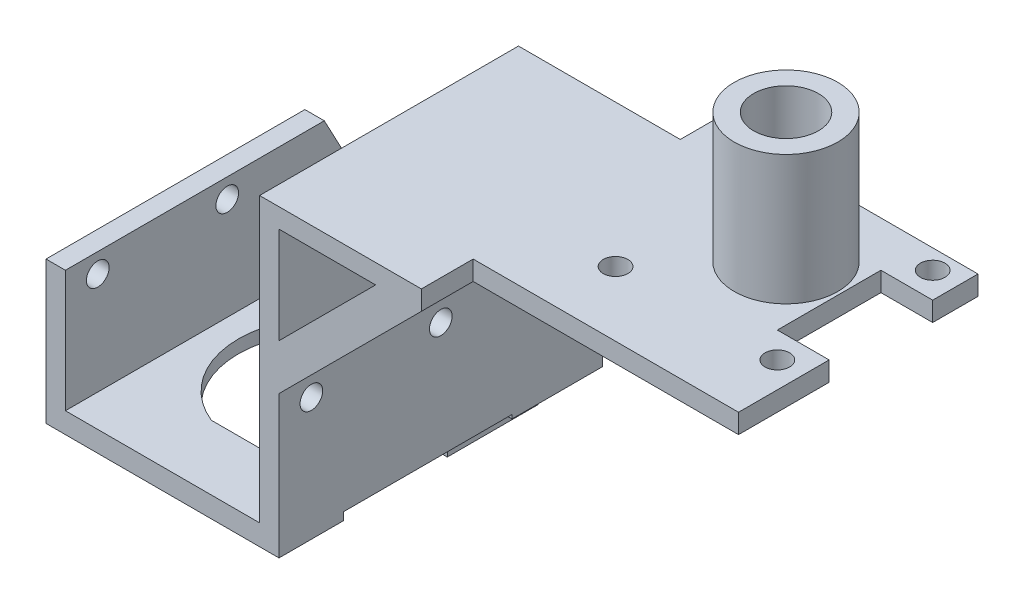
from build123d import *

# Parameters (mm, degrees)
SKETCH_1_W            = 36
SKETCH_1_H            = 40
EXTRUDE_1_DEPTH       = 3
SKETCH_2_W            = 3
SKETCH_2_H            = 40
EXTRUDE_2_DEPTH       = 18.8
SKETCH_3_R            = 14
CUT_EXTRUDE_1_DEPTH   = 9
SKETCH_4_W            = 36
SKETCH_4_H            = 3
EXTRUDE_3_DEPTH       = 10
SKETCH_6_R            = 2.7
CUT_EXTRUDE_3_DEPTH   = 10
SKETCH_7_R            = 1.75
CUT_EXTRUDE_4_DEPTH   = 52.68404009
SKETCH_9_W            = 25
SKETCH_9_H            = 3
SKETCH_9_W_2          = 3
SKETCH_9_H_2          = 9.3
EXTRUDE_4_DEPTH       = 20
CHAMFER_1_SIZE        = 5
CUT_EXTRUDE_START     = -30
SKETCH_10_R           = 2.7
CUT_EXTRUDE_5_DEPTH   = 30
SKETCH_11_W           = 40.05397725
SKETCH_11_H           = 18.071111192
CUT_EXTRUDE_6_DEPTH   = 52.68404009
EXTRUDE_START         = 2.5
SKETCH_12_W           = 36
SKETCH_12_H           = 20
SKETCH_12_R           = 2.7
EXTRUDE_5_DEPTH       = 2.5
SKETCH_13_W           = 62.12277329
SKETCH_13_H           = 35.561448302
CUT_EXTRUDE_7_DEPTH   = 1
SKETCH_16_W           = 60
SKETCH_16_H           = 3
SKETCH_16_W_2         = 3
SKETCH_16_H_2         = 25
EXTRUDE_7_DEPTH       = 65
EXTRUDE_START_2       = 8
EXTRUDE_8_DEPTH       = 8
SKETCH_19_W           = 125.229267156
SKETCH_19_H           = 103.922898786
CUT_EXTRUDE_9_DEPTH   = 0.5
SKETCH_20_W           = 154.797288569
SKETCH_20_H           = 90.443359613
CUT_EXTRUDE_10_DEPTH  = 1.8
SKETCH_21_W           = 11.155684717
SKETCH_21_H           = 2.603751016
EXTRUDE_9_DEPTH       = 3
EXTRUDE_10_DEPTH      = 10
EXTRUDE_10_DEPTH_BACK = 4
SKETCH_22_W           = 36
SKETCH_22_H           = 3.2
SKETCH_23_R           = 1.75
CUT_EXTRUDE_12_DEPTH  = 10
SKETCH_26_W           = 12.845915964
SKETCH_26_H           = 7.377373426
EXTRUDE_11_DEPTH      = 3.2
SKETCH_27_W           = 116.42408431
SKETCH_27_H           = 62.505927617
CUT_EXTRUDE_13_DEPTH  = 10
SKETCH_29_W           = 89.791123847
SKETCH_29_H           = 12.28472202
SKETCH_29_W_2         = 107.401489541
SKETCH_29_H_2         = 29.785433334
CUT_EXTRUDE_14_DEPTH  = 25
SKETCH_30_W           = 3
SKETCH_30_H           = 18.8
EXTRUDE_12_DEPTH      = 17
SKETCH_31_W           = 80.768529078
SKETCH_31_H           = 45.765209612
CUT_EXTRUDE_15_DEPTH  = 0.6
SKETCH_32_W           = 23
SKETCH_32_H           = 2.8
SKETCH_32_W_2         = 3
SKETCH_32_H_2         = 9.9
EXTRUDE_13_DEPTH      = 14
SKETCH_34_R           = 2.2
CUT_EXTRUDE_17_DEPTH  = 97.806198149
SKETCH_35_W           = 168.711651586
SKETCH_35_H           = 128.925269833
CUT_EXTRUDE_18_DEPTH  = 7
SKETCH_36_W           = 30.780953922
SKETCH_36_H           = 20.383466973
CUT_EXTRUDE_19_DEPTH  = 43.8
SKETCH_38_W           = 37
SKETCH_38_H           = 5
CUT_EXTRUDE_20_DEPTH  = 10
SKETCH_45_W           = 37
SKETCH_45_H           = 3
EXTRUDE_14_DEPTH      = 3
HOLE_WIZARD_1_D       = 3.8
SKETCH_51_W           = 37
SKETCH_51_H           = 8
CUT_EXTRUDE_21_DEPTH  = 10
EXTRUDE_15_DEPTH      = 3
EXTRUDE_16_DEPTH      = 3
EXTRUDE_17_DEPTH      = 8
EXTRUDE_18_DEPTH      = 1.5
SKETCH_58_W           = 5
SKETCH_58_H           = 7.3
EXTRUDE_19_DEPTH      = 3
SKETCH_59_W           = 38
SKETCH_59_H           = 5
EXTRUDE_20_DEPTH      = 3
HOLE_WIZARD_2_D       = 3.8
SKETCH_62_W           = 37
SKETCH_62_H           = 3
EXTRUDE_21_DEPTH      = 3
HOLE_WIZARD_3_D       = 3.8
HOLE_WIZARD_3_DEPTH   = 56.5
SKETCH_65_W           = 8
SKETCH_65_H           = 16
CUT_EXTRUDE_22_DEPTH  = 10
SKETCH_73_R           = 8
EXTRUDE_22_DEPTH      = 20
SKETCH_74_R           = 5
CUT_EXTRUDE_23_DEPTH  = 20
HOLE_WIZARD_4_D       = 8


with BuildPart() as part:
    # 草图1 → 凸台-拉伸1 (new body)
    with BuildSketch(Plane(origin=(0, 0, 0), x_dir=(1, 0, 0), z_dir=(0, 1, 0))):
        Rectangle(SKETCH_1_W, SKETCH_1_H)
    extrude(amount=EXTRUDE_1_DEPTH)

    # 草图2 → 凸台-拉伸2 (add)
    with BuildSketch(Plane(origin=(0, 3, 0), x_dir=(1, 0, 0), z_dir=(0, 1, 0))):
        with Locations((-16.5, 0)):
            Rectangle(SKETCH_2_W, SKETCH_2_H)
        with Locations((16.5, 0)):
            Rectangle(SKETCH_2_W, SKETCH_2_H)
    extrude(amount=EXTRUDE_2_DEPTH)

    # 草图3 → 切除-拉伸1 (cut)
    with BuildSketch(Plane(origin=(0, 0, 0), x_dir=(-1, 0, 0), z_dir=(0, -1, 0))):
        with Locations(Location((-2.75, 3.000025, 0), (0, 0, 90))):
            Circle(SKETCH_3_R)
    extrude(amount=-CUT_EXTRUDE_1_DEPTH, mode=Mode.SUBTRACT)

    # 草图4 → 凸台-拉伸3 (add)
    with BuildSketch(Plane.XY.offset(20)):
        with Locations((0, 1.5)):
            Rectangle(SKETCH_4_W, SKETCH_4_H)
    extrude(amount=EXTRUDE_3_DEPTH)

    # 草图6 → 切除-拉伸3 (cut)
    with BuildSketch(Plane(origin=(0, 0, 0), x_dir=(-1, 0, 0), z_dir=(0, -1, 0))):
        with Locations(Location((-2.75, -16.149975, 0), (0, 0, 90))):
            Circle(SKETCH_6_R)
    extrude(amount=-CUT_EXTRUDE_3_DEPTH, mode=Mode.SUBTRACT)

    # 草图7 → 切除-拉伸4 (cut, through all)
    with BuildSketch(Plane.ZY.offset(18)):
        with Locations((15, 18.8)):
            Circle(SKETCH_7_R)
        with Locations((-5, 18.8)):
            Circle(SKETCH_7_R)
    extrude(amount=-CUT_EXTRUDE_4_DEPTH, mode=Mode.SUBTRACT)

    # 草图9 → 凸台-拉伸4 (add)
    with BuildSketch(Plane.XY.offset(30)):
        with Locations((-2.5, -7.8)):
            Rectangle(SKETCH_9_W, SKETCH_9_H)
        with Locations((-16.5, -4.65)):
            Rectangle(SKETCH_9_W_2, SKETCH_9_H_2)
    extrude(amount=-EXTRUDE_4_DEPTH)

    # 倒角1
    chamfer_1_edges = [part.edges().sort_by_distance(p)[0] for p in [
        (10, -7.8, 30),
    ]]
    chamfer(chamfer_1_edges, length=CHAMFER_1_SIZE)

    # 草图10 → 切除-拉伸5 (cut)
    with BuildSketch(Plane(origin=(0, 0, 0), x_dir=(1, 0, 0), z_dir=(0, 1, 0)).offset(CUT_EXTRUDE_START)):
        with Locations(Location((2.75, -16.149975, 0), (0, 0, 90))):
            Circle(SKETCH_10_R)
    extrude(amount=CUT_EXTRUDE_5_DEPTH, mode=Mode.SUBTRACT)

    # 草图11 → 切除-拉伸6 (cut, through all)
    with BuildSketch(Plane.ZY.offset(18)):
        with Locations((20.026988625, -9.035555596)):
            Rectangle(SKETCH_11_W, SKETCH_11_H)
    extrude(amount=-CUT_EXTRUDE_6_DEPTH, mode=Mode.SUBTRACT)

    # 草图12 → 凸台-拉伸5 (add)
    with BuildSketch(Plane(origin=(0, 0, 0), x_dir=(-1, 0, 0), z_dir=(0, -1, 0)).offset(EXTRUDE_START)):
        with Locations((0, -20)):
            Rectangle(SKETCH_12_W, SKETCH_12_H)
        with Locations(Location((-2.75, -16.149975, 0), (0, 0, 90))):
            Circle(SKETCH_12_R, mode=Mode.SUBTRACT)
    extrude(amount=-EXTRUDE_5_DEPTH)

    # 草图13 → 切除-拉伸7 (cut)
    with BuildSketch(Plane(origin=(0, 0, 0), x_dir=(-1, 0, 0), z_dir=(0, -1, 0))):
        with Locations((0.086945799, 7.780724151)):
            Rectangle(SKETCH_13_W, SKETCH_13_H)
    extrude(amount=-CUT_EXTRUDE_7_DEPTH, mode=Mode.SUBTRACT)

    # 草图16 → 凸台-拉伸7 (add)
    with BuildSketch(Plane.XY.offset(20)):
        with Locations((48, 45.3)):
            Rectangle(SKETCH_16_W, SKETCH_16_H)
        with Locations((16.5, 34.3)):
            Rectangle(SKETCH_16_W_2, SKETCH_16_H_2)
    extrude(amount=-EXTRUDE_7_DEPTH)

    # 草图17 → 凸台-拉伸8 (add)
    with BuildSketch(Plane(origin=(0, 9, 0), x_dir=(-1, 0, 0), z_dir=(0, -1, 0)).offset(EXTRUDE_START_2)):
        with BuildLine():
            Line((-15, -3.777695856), (-15, 9.777745856))
            ThreePointArc((-15, 9.777745856), (-16.75, 3.000025), (-15, -3.777695856))
        make_face()
    extrude(amount=-EXTRUDE_8_DEPTH)

    # 草图19 → 切除-拉伸9 (cut)
    with BuildSketch(Plane(origin=(0, -2.5, 0), x_dir=(-1, 0, 0), z_dir=(0, -1, 0))):
        with Locations((5.272239112, -16.1971882)):
            Rectangle(SKETCH_19_W, SKETCH_19_H)
    extrude(amount=-CUT_EXTRUDE_9_DEPTH, mode=Mode.SUBTRACT)

    # 草图20 → 切除-拉伸10 (cut)
    with BuildSketch(Plane(origin=(0, -2, 0), x_dir=(-1, 0, 0), z_dir=(0, -1, 0))):
        with Locations((2.880707968, -7.718123237)):
            Rectangle(SKETCH_20_W, SKETCH_20_H)
    extrude(amount=-CUT_EXTRUDE_10_DEPTH, mode=Mode.SUBTRACT)

    # 草图21 → 凸台-拉伸9 (add)
    with BuildSketch(Plane(origin=(0, 0, 0), x_dir=(1, 0, 0), z_dir=(0, 1, 0))):
        with Locations((3.131752483, -11.301875508)):
            Rectangle(SKETCH_21_W, SKETCH_21_H)
    extrude(amount=EXTRUDE_9_DEPTH)

    # 草图22 → 凸台-拉伸10 (add, two sides: drawn at the far end of the back side and taken through both)
    with BuildSketch(Plane(origin=(0, 0, -20), x_dir=(-1, 0, 0), z_dir=(0, 0, -1)).offset(-EXTRUDE_10_DEPTH_BACK)):
        with Locations((0, 1.4)):
            Rectangle(SKETCH_22_W, SKETCH_22_H)
    extrude(amount=EXTRUDE_10_DEPTH + EXTRUDE_10_DEPTH_BACK)

    # 草图23 → 切除-拉伸12 (cut)
    with BuildSketch(Plane(origin=(0, 9, 0), x_dir=(-1, 0, 0), z_dir=(0, -1, 0))):
        with Locations(Location((-2.75, 22.150025, 0), (0, 0, 270))):
            Circle(SKETCH_23_R)
    extrude(amount=CUT_EXTRUDE_12_DEPTH, mode=Mode.SUBTRACT)

    # 草图26 → 凸台-拉伸11 (add, through all)
    with BuildSketch(Plane(origin=(0, 3, 0), x_dir=(1, 0, 0), z_dir=(0, 1, 0))):
        with Locations((3.420651678, -16.929062366)):
            Rectangle(SKETCH_26_W, SKETCH_26_H)
    extrude(amount=-EXTRUDE_11_DEPTH)

    # 草图27 → 切除-拉伸13 (cut)
    with BuildSketch(Plane.XY.offset(30)):
        with Locations((4.783062287, -2.648783639)):
            Rectangle(SKETCH_27_W, SKETCH_27_H)
    extrude(amount=-CUT_EXTRUDE_13_DEPTH, mode=Mode.SUBTRACT)

    # 草图29 → 切除-拉伸14 (cut)
    with BuildSketch(Plane(origin=(0, 46.8, 0), x_dir=(1, 0, 0), z_dir=(0, 1, 0))):
        with Locations((43.319325488, 43.14236101)):
            Rectangle(SKETCH_29_W, SKETCH_29_H)
        with Locations((56.472746777, -26.892716667)):
            Rectangle(SKETCH_29_W_2, SKETCH_29_H_2)
    extrude(amount=-CUT_EXTRUDE_14_DEPTH, mode=Mode.SUBTRACT)

    # 草图30 → 凸台-拉伸12 (add)
    with BuildSketch(Plane(origin=(0, 0, -20), x_dir=(-1, 0, 0), z_dir=(0, 0, -1))):
        with Locations((-16.5, 12.4)):
            Rectangle(SKETCH_30_W, SKETCH_30_H)
    extrude(amount=EXTRUDE_12_DEPTH)

    # 草图31 → 切除-拉伸15 (cut)
    with BuildSketch(Plane(origin=(0, -0.2, 0), x_dir=(-1, 0, 0), z_dir=(0, -1, 0))):
        with Locations((-3.369884793, 29.731080354)):
            Rectangle(SKETCH_31_W, SKETCH_31_H)
    extrude(amount=-CUT_EXTRUDE_15_DEPTH, mode=Mode.SUBTRACT)

    # 草图32 → 凸台-拉伸13 (add)
    with BuildSketch(Plane(origin=(0, 0, -30), x_dir=(-1, 0, 0), z_dir=(0, 0, -1))):
        with Locations((3.5, -8.3)):
            Rectangle(SKETCH_32_W, SKETCH_32_H)
        with Locations((16.5, -1.95)):
            Rectangle(SKETCH_32_W_2, SKETCH_32_H_2)
        with Locations((16.5, -8.3)):
            Rectangle(SKETCH_32_W_2, SKETCH_32_H)
    extrude(amount=-EXTRUDE_13_DEPTH)

    # 草图34 → 切除-拉伸17 (cut, through all)
    with BuildSketch(Plane(origin=(0, 3, 0), x_dir=(1, 0, 0), z_dir=(0, 1, 0))):
        with Locations(Location((2.75, 22.150025, 0), (0, 0, 270))):
            Circle(SKETCH_34_R)
    extrude(amount=-CUT_EXTRUDE_17_DEPTH, mode=Mode.SUBTRACT)

    # 草图35 → 切除-拉伸18 (cut)
    with BuildSketch(Plane(origin=(0, 0, -37), x_dir=(-1, 0, 0), z_dir=(0, 0, -1))):
        with Locations((-14.403539842, 2.608943066)):
            Rectangle(SKETCH_35_W, SKETCH_35_H)
    extrude(amount=-CUT_EXTRUDE_18_DEPTH, mode=Mode.SUBTRACT)

    # 草图36 → 切除-拉伸19 (cut)
    with BuildSketch(Plane(origin=(0, 46.8, 0), x_dir=(1, 0, 0), z_dir=(0, 1, 0))):
        with Locations((25.609523039, 30.191733487)):
            Rectangle(SKETCH_36_W, SKETCH_36_H)
    extrude(amount=-CUT_EXTRUDE_19_DEPTH, mode=Mode.SUBTRACT)

    # 草图38 → 切除-拉伸20 (cut)
    with BuildSketch(Plane(origin=(0, 46.8, 0), x_dir=(1, 0, 0), z_dir=(0, 1, 0))):
        with Locations((59.5, 27.5)):
            Rectangle(SKETCH_38_W, SKETCH_38_H)
    extrude(amount=-CUT_EXTRUDE_20_DEPTH, mode=Mode.SUBTRACT)

    # 草图45 → 凸台-拉伸14 (add)
    with BuildSketch(Plane(origin=(0, 0, -25), x_dir=(-1, 0, 0), z_dir=(0, 0, -1))):
        with Locations((-59.5, 45.3)):
            Rectangle(SKETCH_45_W, SKETCH_45_H)
    extrude(amount=EXTRUDE_14_DEPTH)

    # 孔1 (through all)
    with Locations(Plane(origin=(0, 46.8, 0), x_dir=(1, 0, 0), z_dir=(0, 1, 0))):
        with Locations((52, 22), (52, -2), (77, 22), (77, -2)):
            Hole(HOLE_WIZARD_1_D / 2)

    # 草图51 → 切除-拉伸21 (cut)
    with BuildSketch(Plane(origin=(0, 46.8, 0), x_dir=(1, 0, 0), z_dir=(0, 1, 0))):
        with Locations((59.5, 24)):
            Rectangle(SKETCH_51_W, SKETCH_51_H)
    extrude(amount=-CUT_EXTRUDE_21_DEPTH, mode=Mode.SUBTRACT)

    # 草图52 → 凸台-拉伸15 (add)
    with BuildSketch(Plane.ZY.offset(18)):
        Polygon((-30, 3), (-20, 21.8), (-20, 3), align=None)
    extrude(amount=-EXTRUDE_15_DEPTH)

    # 草图54 → 凸台-拉伸16 (add)
    with BuildSketch(Plane(origin=(18, 0, 0), x_dir=(0, 0, -1), z_dir=(1, 0, 0))):
        Polygon((30, 3), (20, 3), (20, 23.4), align=None)
    extrude(amount=-EXTRUDE_16_DEPTH)

    # 草图55 → 凸台-拉伸17 (add)
    with BuildSketch(Plane.XY.offset(12)):
        Polygon((15, 21.8), (18, 21.8), (18, 28.871067812), (18, 43.8), (32.928932188, 43.8), (40, 43.8), (40, 46.8), (15, 46.8), align=None)
        Polygon((18, 28.871067812), (18, 21.8), (40, 43.8), (32.928932188, 43.8), align=None)
    extrude(amount=EXTRUDE_17_DEPTH)

    # 草图56 → 凸台-拉伸18 (add, symmetric)
    with BuildSketch(Plane.XY.offset(-4)):
        Polygon((18, 21.8), (40, 43.8), (32.928932188, 43.8), (18, 28.871067812), align=None)
    extrude(amount=EXTRUDE_18_DEPTH, both=True)

    # 草图58 → 凸台-拉伸19 (add)
    with BuildSketch(Plane(origin=(0, 0, -30), x_dir=(-1, 0, 0), z_dir=(0, 0, -1))):
        with Locations((12.5, -3.25)):
            Rectangle(SKETCH_58_W, SKETCH_58_H)
    extrude(amount=-EXTRUDE_19_DEPTH)

    # 草图59 → 凸台-拉伸20 (add)
    with BuildSketch(Plane(origin=(0, 46.8, 0), x_dir=(1, 0, 0), z_dir=(0, 1, 0))):
        with Locations((59, 22.5)):
            Rectangle(SKETCH_59_W, SKETCH_59_H)
    extrude(amount=-EXTRUDE_20_DEPTH)

    # 孔2 (through all)
    with Locations(Plane(origin=(0, 46.8, 0), x_dir=(1, 0, 0), z_dir=(0, 1, 0))):
        with Locations((52, 22), (77, 22)):
            Hole(HOLE_WIZARD_2_D / 2)

    # 草图62 → 凸台-拉伸21 (add)
    with BuildSketch(Plane(origin=(78, 0, 0), x_dir=(0, 0, -1), z_dir=(1, 0, 0))):
        with Locations((6.5, 45.3)):
            Rectangle(SKETCH_62_W, SKETCH_62_H)
    extrude(amount=EXTRUDE_21_DEPTH)

    # 孔3
    with Locations(Plane(origin=(0, 46.8, 0), x_dir=(1, 0, 0), z_dir=(0, 1, 0))):
        with Locations((77, -2), (77, 22)):
            Hole(HOLE_WIZARD_3_D / 2, depth=HOLE_WIZARD_3_DEPTH)

    # 草图65 → 切除-拉伸22 (cut)
    with BuildSketch(Plane(origin=(0, 46.8, 0), x_dir=(1, 0, 0), z_dir=(0, 1, 0))):
        with Locations((77, 10)):
            Rectangle(SKETCH_65_W, SKETCH_65_H)
    extrude(amount=-CUT_EXTRUDE_22_DEPTH, mode=Mode.SUBTRACT)

    # 草图73 → 凸台-拉伸22 (add)
    with BuildSketch(Plane(origin=(0, 46.8, 0), x_dir=(1, 0, 0), z_dir=(0, 1, 0))):
        with Locations(Location((64.521127225, 11.818194149, 0), (0, 0, 90))):
            Circle(SKETCH_73_R)
    extrude(amount=EXTRUDE_22_DEPTH)

    # 草图74 → 切除-拉伸23 (cut)
    with BuildSketch(Plane(origin=(0, 66.8, 0), x_dir=(1, 0, 0), z_dir=(0, 1, 0))):
        with Locations(Location((64.521127225, 11.818194149, 0), (0, 0, 270))):
            Circle(SKETCH_74_R)
    extrude(amount=-CUT_EXTRUDE_23_DEPTH, mode=Mode.SUBTRACT)

    # 孔4 (through all)
    with Locations(Plane(origin=(0, 46.8, 0), x_dir=(1, 0, 0), z_dir=(0, 1, 0))):
        with Locations((64.521127225, 11.818194149)):
            Hole(HOLE_WIZARD_4_D / 2)


solid = part.part
